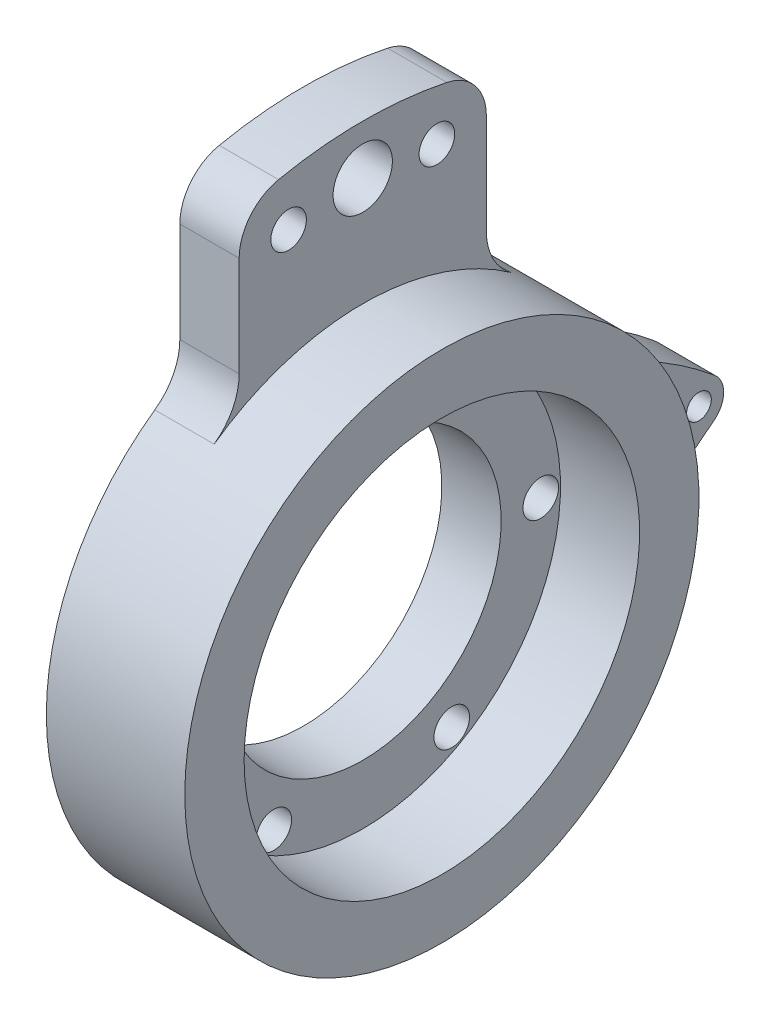
from build123d import *

# Parameters (mm, degrees)
BOSS_EXTRUDE2_DEPTH   = 6
M3_CLEARANCE_HOLE1_D  = 2.5
SKETCH14_R            = 3
BOSS_EXTRUDE4_DEPTH   = 6
M3_CLEARANCE_HOLE2_D  = 3.6
CIRPATTERN1_COUNT     = 6
FILLET1_R             = 6
M3X0_5_TAPPED_HOLE1_D = 3.6


with BuildPart() as part:
    # Sketch1 → Revolve1 (revolve)
    with BuildSketch(Plane.XY, mode=Mode.PRIVATE) as revolve1_sk:
        Polygon((0, 14), (6, 14), (6, 20), (14, 20), (14, 26), (0, 26), align=None)
    revolve(revolve1_sk.sketch.rotate(Axis((-2.257208118, 0, 0), (1, 0, 0)), 90), axis=Axis((-2.257208118, 0, 0), (1, 0, 0)))

    # Sketch3 → Boss-Extrude2 (add)
    with BuildSketch(Plane(origin=(0, 0, 0), x_dir=(0, 0, -1), z_dir=(1, 0, 0))):
        with BuildLine():
            ThreePointArc((24, -10), (24.831302178, -8.742992446), (26.068711806, -7.882789726))
            ThreePointArc((26.068711806, -7.882789726), (31.05103074, -5.234546759), (35.611149804, -1.911595226))
            ThreePointArc((35.611149804, -1.911595226), (36.5, 0), (35.611149804, 1.911595226))
            ThreePointArc((35.611149804, 1.911595226), (31.05103074, 5.234546759), (26.068711806, 7.882789726))
            ThreePointArc((26.068711806, 7.882789726), (24.831302178, 8.742992446), (24, 10))
            ThreePointArc((24, 10), (26, 0), (24, -10))
        make_face()
    extrude(amount=BOSS_EXTRUDE2_DEPTH)

    # M3 Clearance Hole1 (through all)
    with Locations(Plane.ZY):
        with Locations((-34, 0)):
            Hole(M3_CLEARANCE_HOLE1_D / 2)

    # Sketch14 → Boss-Extrude4 (add)
    with BuildSketch(Plane(origin=(0, 0, 0), x_dir=(0, 0, -1), z_dir=(1, 0, 0))):
        with BuildLine():
            Line((-12.5, 36.231892029), (-12.5, 22.79802623))
            ThreePointArc((-12.5, 22.79802623), (0, 26), (12.5, 22.79802623))
            Line((12.5, 22.79802623), (12.5, 36.231892029))
            ThreePointArc((12.5, 36.231892029), (11.377342361, 39.388823485), (8.513513514, 41.128093655))
            ThreePointArc((8.513513514, 41.128093655), (0, 42), (-8.513513514, 41.128093655))
            ThreePointArc((-8.513513514, 41.128093655), (-11.377342361, 39.388823485), (-12.5, 36.231892029))
        make_face()
        with Locations((0, 37)):
            Circle(SKETCH14_R, mode=Mode.SUBTRACT)
    extrude(amount=BOSS_EXTRUDE4_DEPTH)

    # M3 Clearance Hole2 (through all)
    with Locations(Plane.ZY):
        with Locations((18, 0)):
            m3_clearance_hole2 = Hole(M3_CLEARANCE_HOLE2_D / 2)

    # CirPattern1: M3 Clearance Hole2 ×6 about axis
    cirpattern1_axis = Axis((0, 0, 0), (1, 0, 0))
    for i in range(1, CIRPATTERN1_COUNT):
        add(m3_clearance_hole2.rotate(cirpattern1_axis, i * 360 / CIRPATTERN1_COUNT), mode=Mode.SUBTRACT)

    # Fillet1
    fillet1_edges = [part.edges().sort_by_distance(p)[0] for p in [
        (3, 22.79802623, 12.5),
        (3, 22.79802623, -12.5),
    ]]
    fillet(fillet1_edges, radius=FILLET1_R)

    # M3x0.5 Tapped Hole1 (through all)
    with Locations(Plane.ZY):
        with Locations((7.5, 36.231892029), (-7.5, 36.231892029)):
            Hole(M3X0_5_TAPPED_HOLE1_D / 2)


solid = part.part
